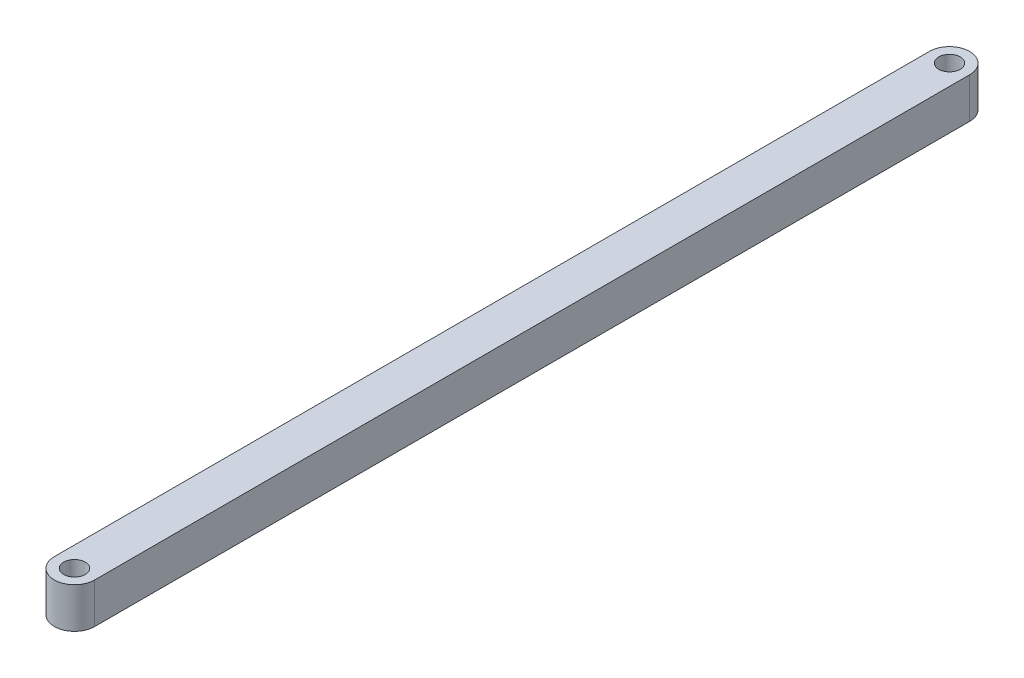
from build123d import *

# Parameters (mm, degrees)
SKETCH_1_R      = 1.6
EXTRUDE_1_DEPTH = 6


with BuildPart() as part:
    # 草图1 → 凸台-拉伸1 (new body)
    with BuildSketch(Plane(origin=(0, 0, 0), x_dir=(1, 0, 0), z_dir=(0, 1, 0))):
        with BuildLine():
            Line((-3, -64.996300345), (-3, 64.996300345))
            ThreePointArc((-3, 64.996300345), (0, 67.996300345), (3, 64.996300345))
            Line((3, 64.996300345), (3, -64.996300345))
            ThreePointArc((3, -64.996300345), (0, -67.996300345), (-3, -64.996300345))
        make_face()
        with Locations(Location((0, 64.996300345, 0), (0, 0, 270))):
            Circle(SKETCH_1_R, mode=Mode.SUBTRACT)
        with Locations(Location((0, -64.996300345, 0), (0, 0, 270))):
            Circle(SKETCH_1_R, mode=Mode.SUBTRACT)
    extrude(amount=EXTRUDE_1_DEPTH)


solid = part.part
